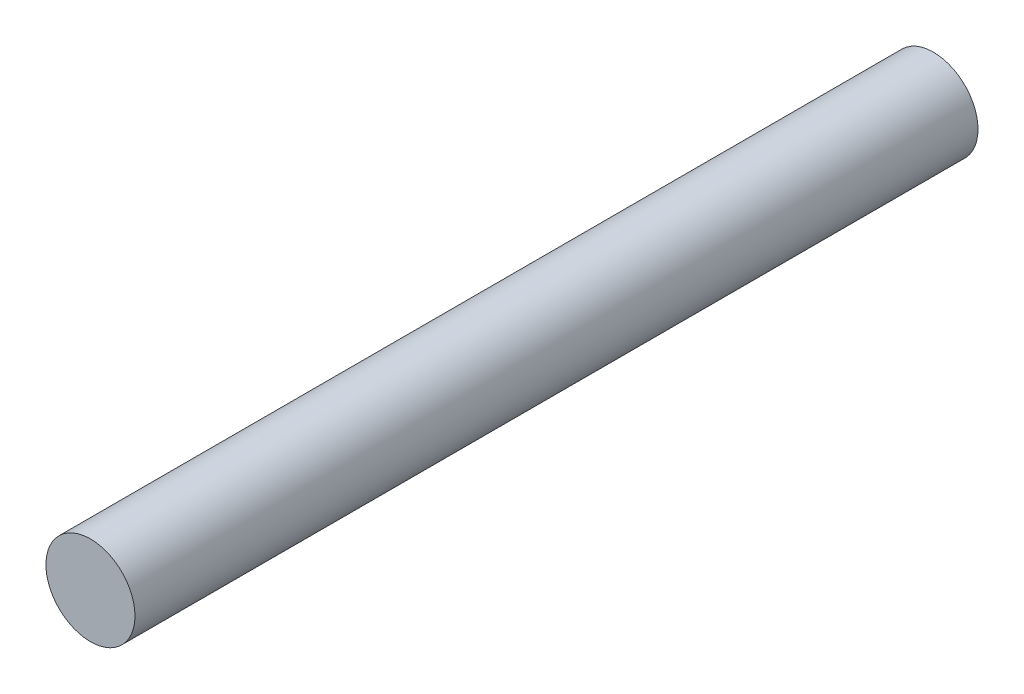
from build123d import *

# Parameters (mm, degrees)
SKETCH_1_R      = 9
EXTRUDE_1_DEPTH = 170.35


with BuildPart() as part:
    # Эскиз1 → Вытянуть1 (new body)
    with BuildSketch(Plane.XY):
        Circle(SKETCH_1_R)
    extrude(amount=EXTRUDE_1_DEPTH)


solid = part.part
